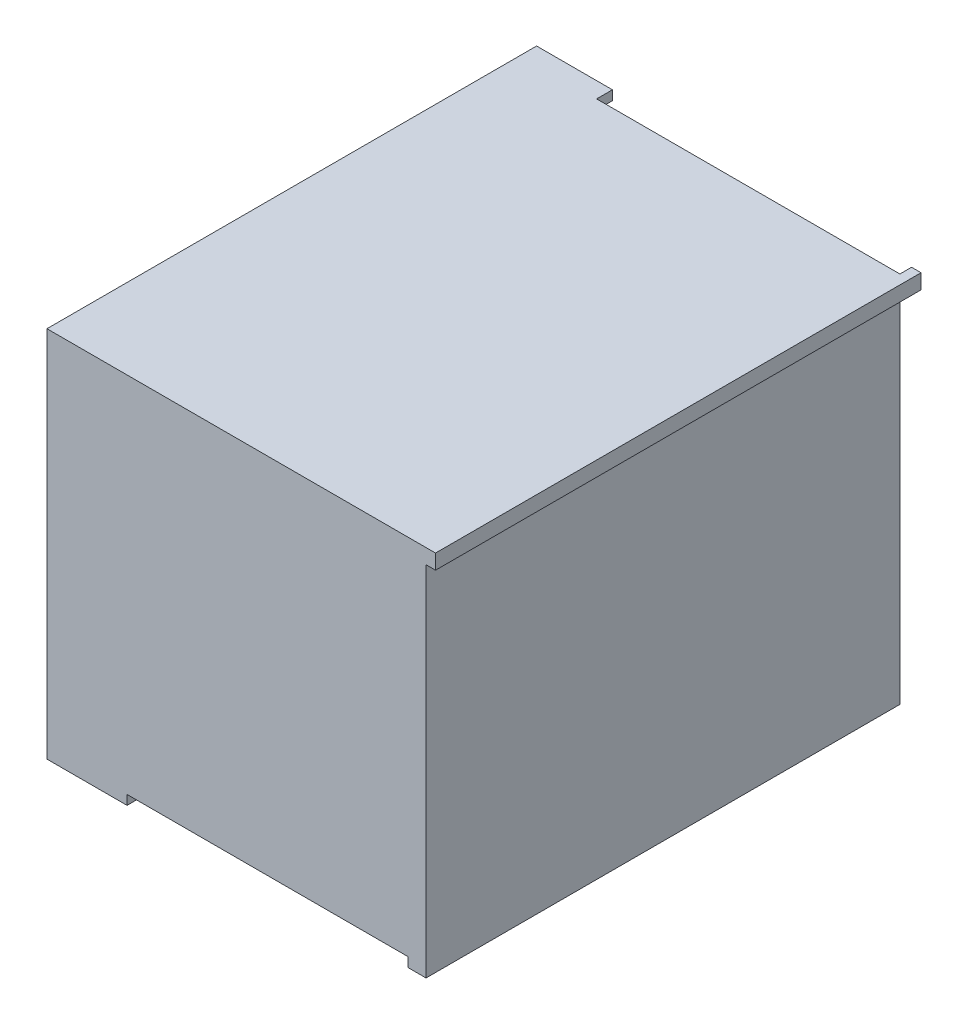
from build123d import *

# Parameters (mm, degrees)
SKETCH1_W           = 1200
SKETCH1_H           = 1150
BOSS_EXTRUDE1_DEPTH = 1500
SKETCH2_W           = 57.803468208
SKETCH2_H           = 1500
SKETCH2_W_2         = 253.585640565
BOSS_EXTRUDE2_DEPTH = 30
SKETCH3_W           = 1536.946487479
SKETCH3_H           = 47.081819152
BOSS_EXTRUDE3_DEPTH = 30
SKETCH4_W           = 239.993344336
SKETCH4_H           = 1550
BOSS_EXTRUDE5_DEPTH = 30


with BuildPart() as part:
    # Sketch1 → Boss-Extrude1 (new body)
    with BuildSketch(Plane.XY):
        with Locations((-542.196531792, -155.924855491)):
            Rectangle(SKETCH1_W, SKETCH1_H)
    extrude(amount=BOSS_EXTRUDE1_DEPTH)

    # Sketch2 → Boss-Extrude2 (add)
    with BuildSketch(Plane.XZ.offset(730.924855491)):
        with Locations((28.901734104, 750)):
            Rectangle(SKETCH2_W, SKETCH2_H)
        with Locations((-1015.403711509, 750)):
            Rectangle(SKETCH2_W_2, SKETCH2_H)
    extrude(amount=BOSS_EXTRUDE2_DEPTH)

    # Sketch3 → Boss-Extrude3 (add)
    with BuildSketch(Plane(origin=(57.803468208, 0, 0), x_dir=(0, 0, -1), z_dir=(1, 0, 0))):
        with Locations((-731.52675626, 395.534234933)):
            Rectangle(SKETCH3_W, SKETCH3_H)
    extrude(amount=BOSS_EXTRUDE3_DEPTH)

    # Sketch4 → Boss-Extrude5 (add)
    with BuildSketch(Plane(origin=(0, 419.075144509, 0), x_dir=(1, 0, 0), z_dir=(0, 1, 0))):
        with Locations((-1022.199859624, -725)):
            Rectangle(SKETCH4_W, SKETCH4_H)
    extrude(amount=-BOSS_EXTRUDE5_DEPTH)


solid = part.part
